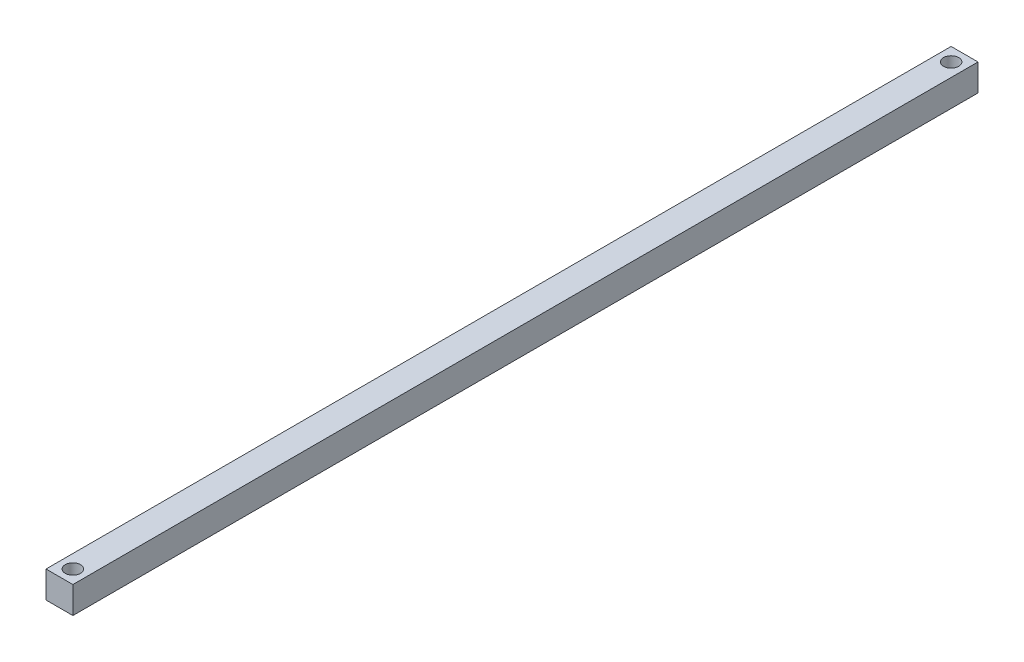
from build123d import *

# Parameters (mm, degrees)
SKETCH1_W           = 15
SKETCH1_H           = 15
BOSS_EXTRUDE1_DEPTH = 252.5
HOLE2_D             = 8.5
HOLE2_CBORE_D       = 14
HOLE2_CBORE_DEPTH   = 8


with BuildPart() as part:
    # Sketch1 → Boss-Extrude1 (new, symmetric)
    with BuildSketch(Plane.XY):
        Rectangle(SKETCH1_W, SKETCH1_H)
    extrude(amount=BOSS_EXTRUDE1_DEPTH, both=True)

    # Hole2 (through all)
    with Locations(Plane(origin=(0, -7.5, 0), x_dir=(-1, 0, 0), z_dir=(0, -1, 0))):
        with Locations((0, 245)):
            hole2 = CounterBoreHole(HOLE2_D / 2, HOLE2_CBORE_D / 2, HOLE2_CBORE_DEPTH)

    # Mirror1: Hole2 across plane
    add(hole2.mirror(Plane.XY), mode=Mode.SUBTRACT)


solid = part.part
